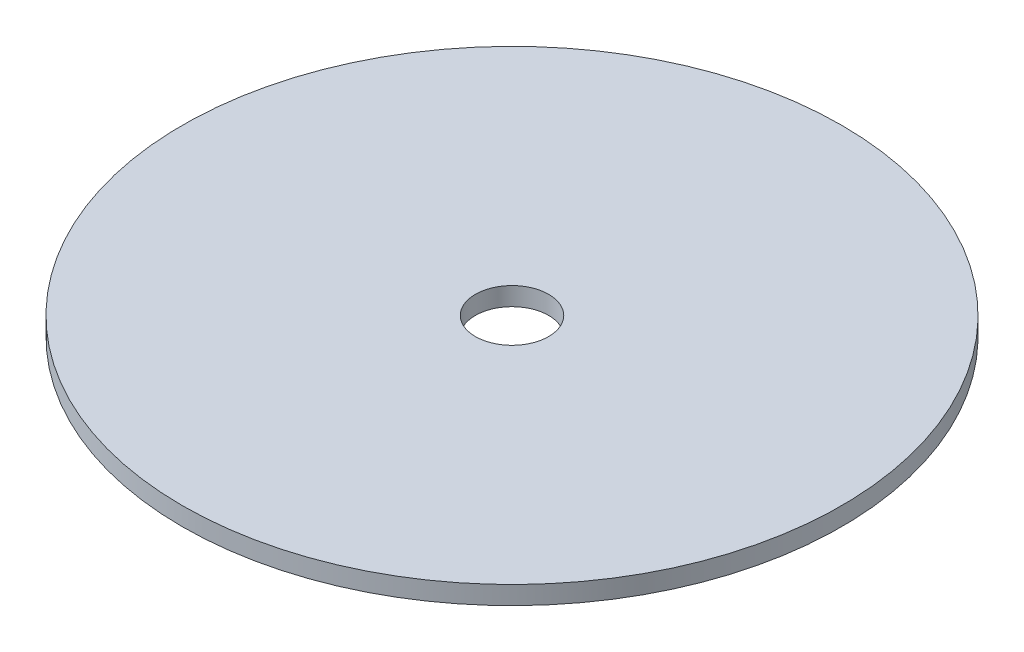
from build123d import *

# Parameters (mm, degrees)
SKETCH1_R           = 36
SKETCH1_R_2         = 4
BOSS_EXTRUDE1_DEPTH = 2


with BuildPart() as part:
    # Sketch1 → Boss-Extrude1 (new body)
    with BuildSketch(Plane(origin=(0, 0, 0), x_dir=(1, 0, 0), z_dir=(0, 1, 0))):
        with Locations(Location((0, 0, 0), (0, 0, 270))):
            Circle(SKETCH1_R)
        with Locations(Location((0, 0, 0), (0, 0, 270))):
            Circle(SKETCH1_R_2, mode=Mode.SUBTRACT)
    extrude(amount=BOSS_EXTRUDE1_DEPTH)


solid = part.part
